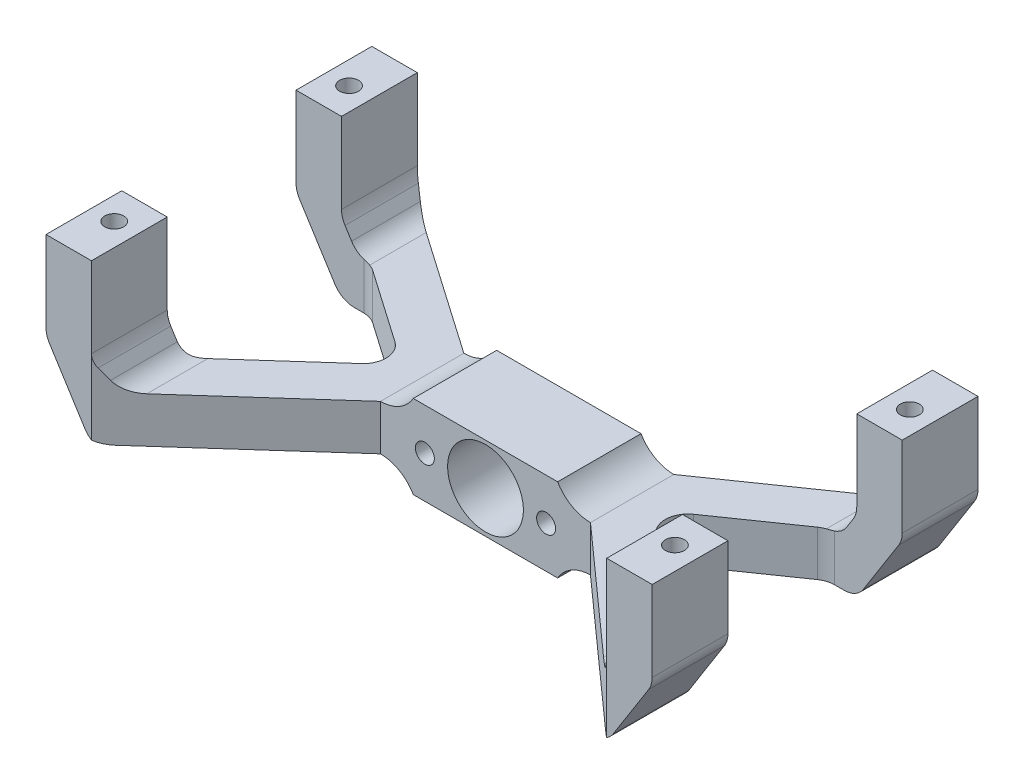
from build123d import *

# Parameters (mm, degrees)
SKETCH15_R            = 5
BOSS_EXTRUDE7_DEPTH   = 21.5
CUT_EXTRUDE6_DEPTH    = 52.132181647
CUT_EXTRUDE7_DEPTH    = 52.132181647
M3_TAPPED_HOLE1_D     = 2.5
M3_TAPPED_HOLE2_D     = 2.5
M3_TAPPED_HOLE2_DEPTH = 7.5
M3_TAPPED_HOLE2_TIP   = 0.751075774


with BuildPart() as part:
    # Sketch15 → Boss-Extrude7 (new, symmetric)
    with BuildSketch(Plane.XY):
        with BuildLine():
            Line((-9.526279442, 70), (9.526279442, 70))
            ThreePointArc((9.526279442, 70), (11.356406461, 71.830127019), (13.856406461, 72.5))
            Line((13.856406461, 72.5), (32.346493939, 72.5))
            ThreePointArc((32.346493939, 72.5), (33.794607035, 72.872649917), (34.882960648, 73.898021026))
            Line((34.882960648, 73.898021026), (39.536466709, 81.266072289))
            ThreePointArc((39.536466709, 81.266072289), (39.881787651, 82.034204793), (40, 82.868051264))
            Line((40, 82.868051264), (40, 93.5))
            Line((40, 93.5), (34, 93.5))
            Line((34, 93.5), (34, 82.868051264))
            ThreePointArc((34, 82.868051264), (33.881787651, 82.034204793), (33.536466709, 81.266072289))
            Line((33.536466709, 81.266072289), (32.672434332, 79.898021026))
            ThreePointArc((32.672434332, 79.898021026), (31.584080719, 78.872649917), (30.135967623, 78.5))
            Line((30.135967623, 78.5), (13.856406461, 78.5))
            ThreePointArc((13.856406461, 78.5), (11.356406461, 79.169872981), (9.526279442, 81))
            Line((9.526279442, 81), (-9.526279442, 81))
            ThreePointArc((-9.526279442, 81), (-11.356406461, 79.169872981), (-13.856406461, 78.5))
            Line((-13.856406461, 78.5), (-30.135967623, 78.5))
            ThreePointArc((-30.135967623, 78.5), (-31.584080719, 78.872649917), (-32.672434332, 79.898021026))
            Line((-32.672434332, 79.898021026), (-33.536466709, 81.266072289))
            ThreePointArc((-33.536466709, 81.266072289), (-33.881787651, 82.034204793), (-34, 82.868051264))
            Line((-34, 82.868051264), (-34, 93.5))
            Line((-34, 93.5), (-40, 93.5))
            Line((-40, 93.5), (-40, 82.868051264))
            ThreePointArc((-40, 82.868051264), (-39.881787651, 82.034204793), (-39.536466709, 81.266072289))
            Line((-39.536466709, 81.266072289), (-34.882960648, 73.898021026))
            ThreePointArc((-34.882960648, 73.898021026), (-33.794607035, 72.872649917), (-32.346493939, 72.5))
            Line((-32.346493939, 72.5), (-13.856406461, 72.5))
            ThreePointArc((-13.856406461, 72.5), (-11.356406461, 71.830127019), (-9.526279442, 70))
        make_face()
        with Locations((0, 75.5)):
            Circle(SKETCH15_R, mode=Mode.SUBTRACT)
    extrude(amount=BOSS_EXTRUDE7_DEPTH, both=True)

    # Sketch16 → Cut-Extrude6 (cut, through all)
    with BuildSketch(Plane.XZ.offset(-70)):
        Polygon((-9.526279442, 3.5), (-13.856406461, 3.5), (-34, 21.5), (34, 21.5), (13.856406461, 3.5), (9.526279442, 3.5), align=None)
        Polygon((-9.526279442, -7.5), (-13.856406461, -7.5), (-34, -21.5), (34, -21.5), (13.856406461, -7.5), (9.526279442, -7.5), align=None)
    extrude(amount=-CUT_EXTRUDE6_DEPTH, mode=Mode.SUBTRACT)

    # Sketch18 → Cut-Extrude7 (cut, through all)
    with BuildSketch(Plane.XZ.offset(-70)):
        with BuildLine():
            Line((-19.430135511, 0.434122818), (-30.959972352, 10.737004611))
            ThreePointArc((-30.959972352, 10.737004611), (-31.889114835, 11.302767724), (-32.95892467, 11.5))
            Line((-32.95892467, 11.5), (-40, 11.5))
            Line((-40, 11.5), (-40, -11.5))
            Line((-40, -11.5), (-31.065089761, -11.5))
            ThreePointArc((-31.065089761, -11.5), (-30.167975157, -11.362723421), (-29.352962435, -10.963456925))
            Line((-29.352962435, -10.963456925), (-19.716960503, -4.266338718))
            ThreePointArc((-19.716960503, -4.266338718), (-18.434657551, -1.985603731), (-19.430135511, 0.434122818))
        make_face()
        with BuildLine():
            Line((40, -11.5), (31.065089761, -11.5))
            ThreePointArc((31.065089761, -11.5), (30.167975157, -11.362723421), (29.352962435, -10.963456925))
            Line((29.352962435, -10.963456925), (19.716960503, -4.266338718))
            ThreePointArc((19.716960503, -4.266338718), (18.434657551, -1.985603731), (19.430135511, 0.434122818))
            Line((19.430135511, 0.434122818), (30.959972352, 10.737004611))
            ThreePointArc((30.959972352, 10.737004611), (31.889114835, 11.302767724), (32.95892467, 11.5))
            Line((32.95892467, 11.5), (40, 11.5))
            Line((40, 11.5), (40, -11.5))
        make_face()
    extrude(amount=-CUT_EXTRUDE7_DEPTH, mode=Mode.SUBTRACT)

    # M3 Tapped Hole1 (through all)
    with Locations(Plane(origin=(-8, 75.5, 3.5), x_dir=(1, 0, 0), z_dir=(0, 0, 1))):
        with Locations((0, 0), (16, 0)):
            Hole(M3_TAPPED_HOLE1_D / 2)

    # M3 Tapped Hole2
    with Locations(Plane(origin=(-37, 93.5, -15.5), x_dir=(0, 0, 1), z_dir=(0, 1, 0))):
        with Locations((0, 0), (0, 74), (31, 74), (31, 0)):
            Hole(M3_TAPPED_HOLE2_D / 2, depth=M3_TAPPED_HOLE2_DEPTH)
            with Locations((0, 0, -(M3_TAPPED_HOLE2_DEPTH + M3_TAPPED_HOLE2_TIP / 2))):  # 118° drill point
                Cone(0, M3_TAPPED_HOLE2_D / 2, M3_TAPPED_HOLE2_TIP, mode=Mode.SUBTRACT)


solid = part.part
